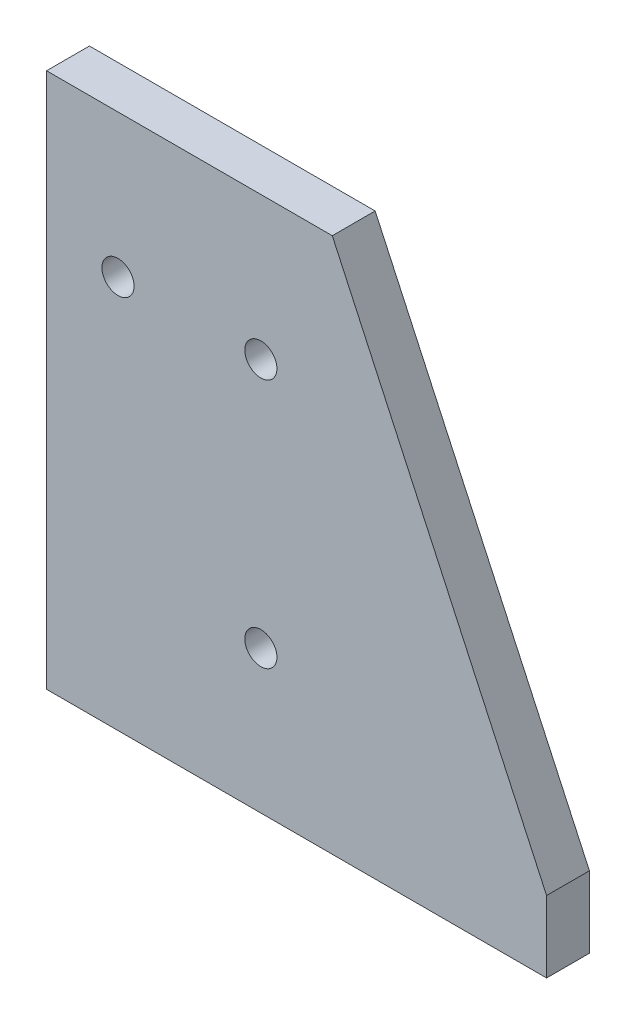
from build123d import *

# Parameters (mm, degrees)
BOSS_EXTRUDE1_DEPTH     = 12
CUT_EXTRUDE1_DEPTH      = 206.533452265
CUT_EXTRUDE1_DEPTH_BACK = 206.533452265
SKETCH2_R               = 4.5
SKETCH3_R               = 2.5
CUT_EXTRUDE3_DEPTH      = 15


with BuildPart() as part:
    # Sketch1 → Boss-Extrude1 (new body)
    with BuildSketch(Plane.XY):
        Polygon((0, 0), (140, 0), (140, 20), (80, 150), (0, 150), align=None)
    extrude(amount=BOSS_EXTRUDE1_DEPTH)

    # Sketch2 → Cut-Extrude1 (cut, two sides: drawn at the far end of the back side and taken through both)
    with BuildSketch(Plane.XY.offset(-CUT_EXTRUDE1_DEPTH_BACK)):
        with Locations((20, 110)):
            Circle(SKETCH2_R)
        with Locations((60, 110)):
            Circle(SKETCH2_R)
        with Locations((60, 40)):
            Circle(SKETCH2_R)
    extrude(amount=CUT_EXTRUDE1_DEPTH + CUT_EXTRUDE1_DEPTH_BACK, mode=Mode.SUBTRACT)

    # Sketch3 → Cut-Extrude3 (cut)
    with BuildSketch(Plane(origin=(0, 0, 0), x_dir=(1, 0, 0), z_dir=(0, 1, 0))):
        with Locations(Location((100, -6, 0), (0, 0, 270))):
            Circle(SKETCH3_R)
        with Locations(Location((125, -6, 0), (0, 0, 270))):
            Circle(SKETCH3_R)
    extrude(amount=CUT_EXTRUDE3_DEPTH, mode=Mode.SUBTRACT)


solid = part.part
